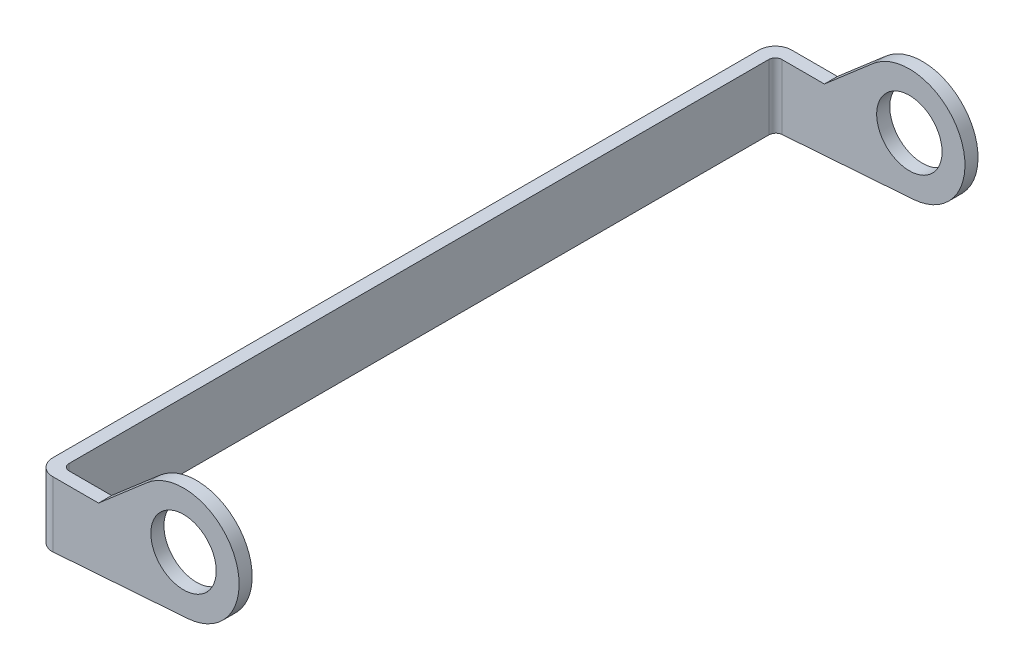
from build123d import *

# Parameters (mm, degrees)
SCHIZZO1_R             = 10
ESTRUSIONE1_DEPTH      = 4
SCHIZZO2_W             = 4
SCHIZZO2_H             = 20
ESTRUSIONE2_DEPTH      = 226
RIPETIZIONE_A_L1_COUNT = 2
RIPETIZIONE_A_L1_PITCH = 222
RACCORDO1_R            = 5
RACCORDO2_R            = 2


with BuildPart() as part:
    # Schizzo1 → Estrusione1 (new body)
    with BuildSketch(Plane.XY):
        with BuildLine():
            Line((-26, 0), (-11.115384615, 12.862667875))
            ThreePointArc((-11.115384615, 12.862667875), (15.70846037, 6.499559431), (1.222434951, -16.955991649))
            Line((1.222434951, -16.955991649), (-41, -20))
            Line((-41, -20), (-45, -20))
            Line((-45, -20), (-45, 0))
            Line((-45, 0), (-26, 0))
        make_face()
        Circle(SCHIZZO1_R, mode=Mode.SUBTRACT)
    estrusione1 = extrude(amount=ESTRUSIONE1_DEPTH)

    # Schizzo2 → Estrusione2 (add)
    with BuildSketch(Plane.XY.offset(4)):
        with Locations((-43, -10)):
            Rectangle(SCHIZZO2_W, SCHIZZO2_H)
    extrude(amount=-ESTRUSIONE2_DEPTH)

    # Ripetizione a L1: Estrusione1 ×2
    with Locations(*[(0, 0, -i * RIPETIZIONE_A_L1_PITCH) for i in range(1, RIPETIZIONE_A_L1_COUNT)]):
        add(estrusione1)

    # Raccordo1
    raccordo1_edges = [part.edges().sort_by_distance(p)[0] for p in [
        (-45, -10, -222),
        (-45, -10, 4),
    ]]
    fillet(raccordo1_edges, radius=RACCORDO1_R)

    # Raccordo2
    raccordo2_edges = [part.edges().sort_by_distance(p)[0] for p in [
        (-41, -10, 0),
        (-41, -10, -218),
    ]]
    fillet(raccordo2_edges, radius=RACCORDO2_R)


solid = part.part
